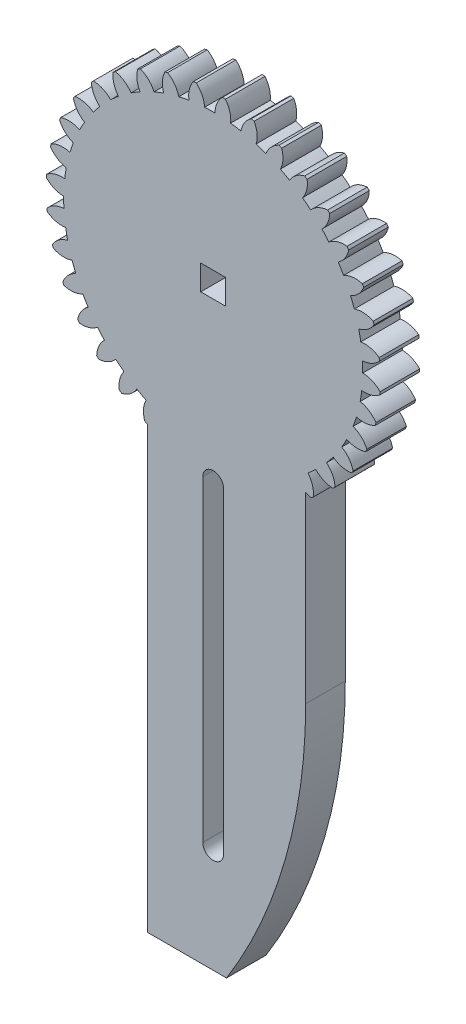
from build123d import *

# Parameters (mm, degrees)
SKETCH3_W           = 3
SKETCH3_H           = 3
BOSS_EXTRUDE2_DEPTH = 4.7625
CUT_EXTRUDE1_DEPTH  = 75.344544811


with BuildPart() as part:
    # Sketch3 → Boss-Extrude2 (new body)
    with BuildSketch(Plane.XY):
        with BuildLine():
            ThreePointArc((-8.236045134, -18.339640055), (-8.080711323, -18.408610521), (-7.9248, -18.476265363))
            Line((-7.9248, -18.476265363), (-7.9248, -71.4248))
            Line((-7.9248, -71.4248), (1.6002, -71.4248))
            ThreePointArc((1.6002, -71.4248), (8.697206621, -55.429656085), (11.1252, -38.1))
            Line((11.1252, -38.1), (11.1252, -16.096281989))
            ThreePointArc((11.1252, -16.096281989), (11.438999025, -16.217619856), (11.764571617, -16.30244434))
            ThreePointArc((11.764571617, -16.30244434), (11.906387518, -16.199159641), (12.047296701, -16.094641313))
            ThreePointArc((12.047296701, -16.094641313), (11.94006726, -14.939578013), (11.395849957, -13.915128449))
            ThreePointArc((11.395849957, -13.915128449), (11.874538892, -13.508942301), (12.338760531, -13.086297588))
            ThreePointArc((12.338760531, -13.086297588), (13.284957408, -13.757401791), (14.416731091, -14.011877157))
            ThreePointArc((14.416731091, -14.011877157), (14.538457289, -13.885535513), (14.659076328, -13.758136431))
            ThreePointArc((14.659076328, -13.758136431), (14.352901305, -12.639241334), (13.639058086, -11.724857804))
            ThreePointArc((13.639058086, -11.724857804), (14.039941177, -11.241719074), (14.423718762, -10.744884042))
            ThreePointArc((14.423718762, -10.744884042), (15.472076804, -11.241487301), (16.630845485, -11.295566177))
            ThreePointArc((16.630845485, -11.295566177), (16.728783393, -11.150006413), (16.825447339, -11.003597532))
            ThreePointArc((16.825447339, -11.003597532), (16.329629709, -9.954867701), (15.467850339, -9.178333286))
            ThreePointArc((15.467850339, -9.178333286), (15.778746954, -8.632921901), (16.070419598, -8.076992631))
            ThreePointArc((16.070419598, -8.076992631), (17.189084976, -8.384005907), (18.339640055, -8.236045134))
            ThreePointArc((18.339640055, -8.236045134), (18.410813878, -8.07569001), (18.480585646, -7.914719891))
            ThreePointArc((18.480585646, -7.914719891), (17.810190576, -6.968020451), (16.826659785, -6.352929755))
            ThreePointArc((16.826659785, -6.352929755), (17.038123489, -5.761817765), (17.228828864, -5.163685888))
            ThreePointArc((17.228828864, -5.163685888), (18.383811499, -5.271780738), (19.491193943, -4.926276027))
            ThreePointArc((19.491193943, -4.926276027), (19.533441101, -4.755997854), (19.574200711, -4.585357493))
            ThreePointArc((19.574200711, -4.585357493), (18.749597816, -3.769453426), (17.674199689, -3.33449567))
            ThreePointArc((17.674199689, -3.33449567), (17.779805264, -2.715643711), (17.863748886, -2.09348316))
            ThreePointArc((17.863748886, -2.09348316), (19.019955212, -1.999375177), (20.050517765, -1.466824517))
            ThreePointArc((20.050517765, -1.466824517), (20.062554599, -1.29179711), (20.073063591, -1.116671327))
            ThreePointArc((20.073063591, -1.116671327), (19.119308013, -0.456353467), (17.984717978, -0.214744621))
            ThreePointArc((17.984717978, -0.214744621), (17.981256653, 0.413043802), (17.955887937, 1.040328995))
            ThreePointArc((17.955887937, 1.040328995), (19.078187211, 1.333780387), (20.000616751, 2.037195715))
            ThreePointArc((20.000616751, 2.037195715), (19.982077528, 2.211654237), (19.962016593, 2.385944333))
            ThreePointArc((19.962016593, 2.385944333), (18.908087711, 2.870612563), (17.748779713, 2.911531335))
            ThreePointArc((17.748779713, 2.911531335), (17.636356657, 3.529181188), (17.502446418, 4.142531277))
            ThreePointArc((17.502446418, 4.142531277), (18.556738145, 4.626409708), (19.343007118, 5.479316785))
            ThreePointArc((19.343007118, 5.479316785), (19.294455143, 5.647905588), (19.244433821, 5.81606428))
            ThreePointArc((19.244433821, 5.81606428), (18.122354732, 6.110356481), (16.973553756, 5.949341884))
            ThreePointArc((16.973553756, 5.949341884), (16.755584889, 6.538086189), (16.517201922, 7.118864843))
            ThreePointArc((16.517201922, 7.118864843), (17.471451981, 7.778467911), (18.097670001, 8.754951588))
            ThreePointArc((18.097670001, 8.754951588), (18.020580502, 8.912548186), (17.942118665, 9.069466059))
            ThreePointArc((17.942118665, 9.069466059), (16.785983174, 9.164440311), (15.682594959, 8.806384692))
            ThreePointArc((15.682594959, 8.806384692), (15.365703152, 9.348334752), (15.030090603, 9.878895305))
            ThreePointArc((15.030090603, 9.878895305), (15.855304589, 10.694181303), (16.30244434, 11.764571617))
            ThreePointArc((16.30244434, 11.764571617), (16.199159641, 11.906387518), (16.094641313, 12.047296701))
            ThreePointArc((16.094641313, 12.047296701), (14.939578013, 11.94006726), (13.915128449, 11.395849957))
            ThreePointArc((13.915128449, 11.395849957), (13.508942301, 11.874538892), (13.086297588, 12.338760531))
            ThreePointArc((13.086297588, 12.338760531), (13.757401791, 13.284957408), (14.011877157, 14.416731091))
            ThreePointArc((14.011877157, 14.416731091), (13.885535513, 14.538457289), (13.758136431, 14.659076328))
            ThreePointArc((13.758136431, 14.659076328), (12.639241334, 14.352901305), (11.724857804, 13.639058086))
            ThreePointArc((11.724857804, 13.639058086), (11.241719074, 14.039941177), (10.744884042, 14.423718762))
            ThreePointArc((10.744884042, 14.423718762), (11.241487301, 15.472076804), (11.295566177, 16.630845485))
            ThreePointArc((11.295566177, 16.630845485), (11.150006413, 16.728783393), (11.003597532, 16.825447339))
            ThreePointArc((11.003597532, 16.825447339), (9.954867701, 16.329629709), (9.178333286, 15.467850339))
            ThreePointArc((9.178333286, 15.467850339), (8.632921901, 15.778746954), (8.076992631, 16.070419598))
            ThreePointArc((8.076992631, 16.070419598), (8.384005907, 17.189084976), (8.236045134, 18.339640055))
            ThreePointArc((8.236045134, 18.339640055), (8.07569001, 18.410813878), (7.914719891, 18.480585646))
            ThreePointArc((7.914719891, 18.480585646), (6.968020451, 17.810190576), (6.352929755, 16.826659785))
            ThreePointArc((6.352929755, 16.826659785), (5.761817765, 17.038123489), (5.163685888, 17.228828864))
            ThreePointArc((5.163685888, 17.228828864), (5.271780738, 18.383811499), (4.926276027, 19.491193943))
            ThreePointArc((4.926276027, 19.491193943), (4.755997854, 19.533441101), (4.585357493, 19.574200711))
            ThreePointArc((4.585357493, 19.574200711), (3.769453426, 18.749597816), (3.33449567, 17.674199689))
            ThreePointArc((3.33449567, 17.674199689), (2.715643711, 17.779805264), (2.09348316, 17.863748886))
            ThreePointArc((2.09348316, 17.863748886), (1.999375177, 19.019955212), (1.466824517, 20.050517765))
            ThreePointArc((1.466824517, 20.050517765), (1.29179711, 20.062554599), (1.116671327, 20.073063591))
            ThreePointArc((1.116671327, 20.073063591), (0.456353467, 19.119308013), (0.214744621, 17.984717978))
            ThreePointArc((0.214744621, 17.984717978), (-0.413043802, 17.981256653), (-1.040328995, 17.955887937))
            ThreePointArc((-1.040328995, 17.955887937), (-1.333780387, 19.078187211), (-2.037195715, 20.000616751))
            ThreePointArc((-2.037195715, 20.000616751), (-2.211654237, 19.982077528), (-2.385944333, 19.962016593))
            ThreePointArc((-2.385944333, 19.962016593), (-2.870612563, 18.908087711), (-2.911531335, 17.748779713))
            ThreePointArc((-2.911531335, 17.748779713), (-3.529181188, 17.636356657), (-4.142531277, 17.502446418))
            ThreePointArc((-4.142531277, 17.502446418), (-4.626409708, 18.556738145), (-5.479316785, 19.343007118))
            ThreePointArc((-5.479316785, 19.343007118), (-5.647905588, 19.294455143), (-5.81606428, 19.244433821))
            ThreePointArc((-5.81606428, 19.244433821), (-6.110356481, 18.122354732), (-5.949341884, 16.973553756))
            ThreePointArc((-5.949341884, 16.973553756), (-6.538086189, 16.755584889), (-7.118864843, 16.517201922))
            ThreePointArc((-7.118864843, 16.517201922), (-7.778467911, 17.471451981), (-8.754951588, 18.097670001))
            ThreePointArc((-8.754951588, 18.097670001), (-8.912548186, 18.020580502), (-9.069466059, 17.942118665))
            ThreePointArc((-9.069466059, 17.942118665), (-9.164440311, 16.785983174), (-8.806384692, 15.682594959))
            ThreePointArc((-8.806384692, 15.682594959), (-9.348334752, 15.365703152), (-9.878895305, 15.030090603))
            ThreePointArc((-9.878895305, 15.030090603), (-10.694181303, 15.855304589), (-11.764571617, 16.30244434))
            ThreePointArc((-11.764571617, 16.30244434), (-11.906387518, 16.199159641), (-12.047296701, 16.094641313))
            ThreePointArc((-12.047296701, 16.094641313), (-11.94006726, 14.939578013), (-11.395849957, 13.915128449))
            ThreePointArc((-11.395849957, 13.915128449), (-11.874538892, 13.508942301), (-12.338760531, 13.086297588))
            ThreePointArc((-12.338760531, 13.086297588), (-13.284957408, 13.757401791), (-14.416731091, 14.011877157))
            ThreePointArc((-14.416731091, 14.011877157), (-14.538457289, 13.885535513), (-14.659076328, 13.758136431))
            ThreePointArc((-14.659076328, 13.758136431), (-14.352901305, 12.639241334), (-13.639058086, 11.724857804))
            ThreePointArc((-13.639058086, 11.724857804), (-14.039941177, 11.241719074), (-14.423718762, 10.744884042))
            ThreePointArc((-14.423718762, 10.744884042), (-15.472076804, 11.241487301), (-16.630845485, 11.295566177))
            ThreePointArc((-16.630845485, 11.295566177), (-16.728783393, 11.150006413), (-16.825447339, 11.003597532))
            ThreePointArc((-16.825447339, 11.003597532), (-16.329629709, 9.954867701), (-15.467850339, 9.178333286))
            ThreePointArc((-15.467850339, 9.178333286), (-15.778746954, 8.632921901), (-16.070419598, 8.076992631))
            ThreePointArc((-16.070419598, 8.076992631), (-17.189084976, 8.384005907), (-18.339640055, 8.236045134))
            ThreePointArc((-18.339640055, 8.236045134), (-18.410813878, 8.07569001), (-18.480585646, 7.914719891))
            ThreePointArc((-18.480585646, 7.914719891), (-17.810190576, 6.968020451), (-16.826659785, 6.352929755))
            ThreePointArc((-16.826659785, 6.352929755), (-17.038123489, 5.761817765), (-17.228828864, 5.163685888))
            ThreePointArc((-17.228828864, 5.163685888), (-18.383811499, 5.271780738), (-19.491193943, 4.926276027))
            ThreePointArc((-19.491193943, 4.926276027), (-19.533441101, 4.755997854), (-19.574200711, 4.585357493))
            ThreePointArc((-19.574200711, 4.585357493), (-18.749597816, 3.769453426), (-17.674199689, 3.33449567))
            ThreePointArc((-17.674199689, 3.33449567), (-17.779805264, 2.715643711), (-17.863748886, 2.09348316))
            ThreePointArc((-17.863748886, 2.09348316), (-19.019955212, 1.999375177), (-20.050517765, 1.466824517))
            ThreePointArc((-20.050517765, 1.466824517), (-20.062554599, 1.29179711), (-20.073063591, 1.116671327))
            ThreePointArc((-20.073063591, 1.116671327), (-19.119308013, 0.456353467), (-17.984717978, 0.214744621))
            ThreePointArc((-17.984717978, 0.214744621), (-17.981256653, -0.413043802), (-17.955887937, -1.040328995))
            ThreePointArc((-17.955887937, -1.040328995), (-19.078187211, -1.333780387), (-20.000616751, -2.037195715))
            ThreePointArc((-20.000616751, -2.037195715), (-19.982077528, -2.211654237), (-19.962016593, -2.385944333))
            ThreePointArc((-19.962016593, -2.385944333), (-18.908087711, -2.870612563), (-17.748779713, -2.911531335))
            ThreePointArc((-17.748779713, -2.911531335), (-17.636356657, -3.529181188), (-17.502446418, -4.142531277))
            ThreePointArc((-17.502446418, -4.142531277), (-18.556738145, -4.626409708), (-19.343007118, -5.479316785))
            ThreePointArc((-19.343007118, -5.479316785), (-19.294455143, -5.647905588), (-19.244433821, -5.81606428))
            ThreePointArc((-19.244433821, -5.81606428), (-18.122354732, -6.110356481), (-16.973553756, -5.949341884))
            ThreePointArc((-16.973553756, -5.949341884), (-16.755584889, -6.538086189), (-16.517201922, -7.118864843))
            ThreePointArc((-16.517201922, -7.118864843), (-17.471451981, -7.778467911), (-18.097670001, -8.754951588))
            ThreePointArc((-18.097670001, -8.754951588), (-18.020580502, -8.912548186), (-17.942118665, -9.069466059))
            ThreePointArc((-17.942118665, -9.069466059), (-16.785983174, -9.164440311), (-15.682594959, -8.806384692))
            ThreePointArc((-15.682594959, -8.806384692), (-15.365703152, -9.348334752), (-15.030090603, -9.878895305))
            ThreePointArc((-15.030090603, -9.878895305), (-15.855304589, -10.694181303), (-16.30244434, -11.764571617))
            ThreePointArc((-16.30244434, -11.764571617), (-16.199159641, -11.906387518), (-16.094641313, -12.047296701))
            ThreePointArc((-16.094641313, -12.047296701), (-14.939578013, -11.94006726), (-13.915128449, -11.395849957))
            ThreePointArc((-13.915128449, -11.395849957), (-13.508942301, -11.874538892), (-13.086297588, -12.338760531))
            ThreePointArc((-13.086297588, -12.338760531), (-13.757401791, -13.284957408), (-14.011877157, -14.416731091))
            ThreePointArc((-14.011877157, -14.416731091), (-13.885535513, -14.538457289), (-13.758136431, -14.659076328))
            ThreePointArc((-13.758136431, -14.659076328), (-12.639241334, -14.352901305), (-11.724857804, -13.639058086))
            ThreePointArc((-11.724857804, -13.639058086), (-11.241719074, -14.039941177), (-10.744884042, -14.423718762))
            ThreePointArc((-10.744884042, -14.423718762), (-11.241487301, -15.472076804), (-11.295566177, -16.630845485))
            ThreePointArc((-11.295566177, -16.630845485), (-11.150006413, -16.728783393), (-11.003597532, -16.825447339))
            ThreePointArc((-11.003597532, -16.825447339), (-9.954867701, -16.329629709), (-9.178333286, -15.467850339))
            ThreePointArc((-9.178333286, -15.467850339), (-8.632921901, -15.778746954), (-8.076992631, -16.070419598))
            ThreePointArc((-8.076992631, -16.070419598), (-8.384005907, -17.189084976), (-8.236045134, -18.339640055))
        make_face()
        Rectangle(SKETCH3_W, SKETCH3_H, mode=Mode.SUBTRACT)
    extrude(amount=BOSS_EXTRUDE2_DEPTH)

    # Sketch5 → Cut-Extrude1 (cut, through all)
    with BuildSketch(Plane.XY.offset(4.7625)):
        with BuildLine():
            Line((-1.25, -58.7248), (-1.25, -20.6248))
            ThreePointArc((-1.25, -20.6248), (0, -19.3748), (1.25, -20.6248))
            Line((1.25, -20.6248), (1.25, -58.7248))
            ThreePointArc((1.25, -58.7248), (0, -59.9748), (-1.25, -58.7248))
        make_face()
    extrude(amount=-CUT_EXTRUDE1_DEPTH, mode=Mode.SUBTRACT)


solid = part.part
